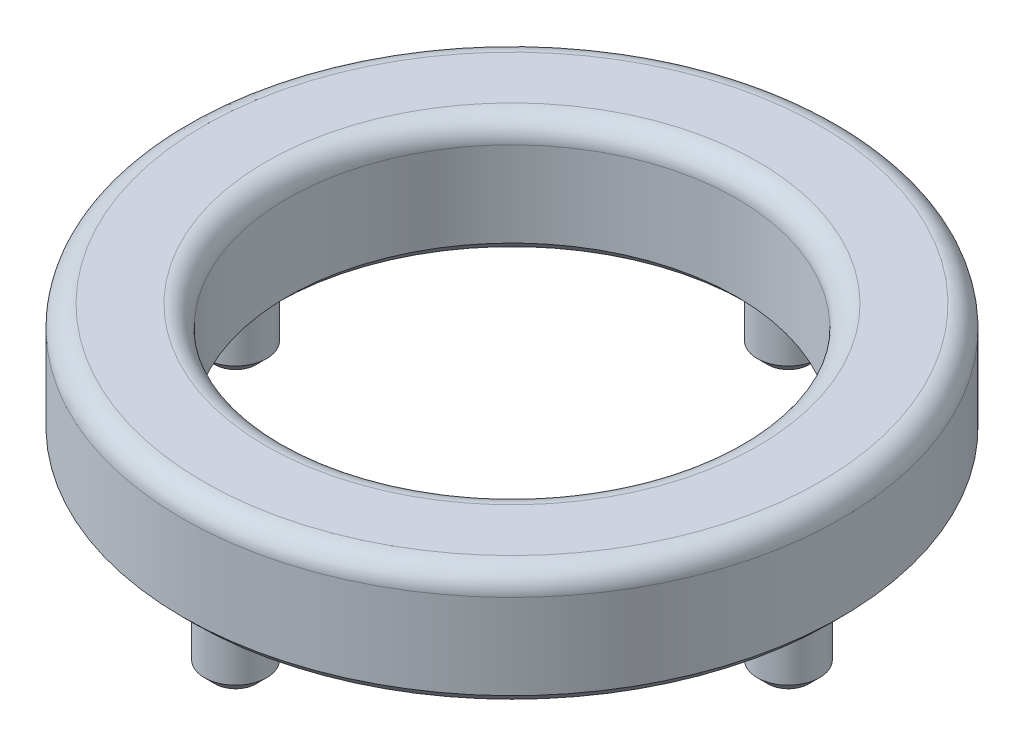
from build123d import *

# Parameters (mm, degrees)
SKETCH_1_R      = 31
SKETCH_1_R_2    = 21.15
EXTRUDE_1_DEPTH = 11
SKETCH_1_3_R    = 2.925
EXTRUDE_2_DEPTH = 6
CHAMFER_1_SIZE  = 1
CHAMFER_2_SIZE  = 1
FILLET_1_R      = 2
FILLET_2_R      = 0.4


with BuildPart() as part:
    # Эскиз1 → Бобышка-Вытянуть1 (new body)
    with BuildSketch(Plane(origin=(0, 0, 0), x_dir=(1, 0, 0), z_dir=(0, 1, 0))):
        Circle(SKETCH_1_R)
        Circle(SKETCH_1_R_2, mode=Mode.SUBTRACT)
    extrude(amount=EXTRUDE_1_DEPTH)

    # Эскиз1<3> → Бобышка-Вытянуть2 (add)
    with BuildSketch(Plane(origin=(0, 0, 0), x_dir=(1, 0, 0), z_dir=(0, 1, 0))):
        with Locations((0, 26)):
            Circle(SKETCH_1_3_R)
        with Locations((26, 0)):
            Circle(SKETCH_1_3_R)
        with Locations((0, -26)):
            Circle(SKETCH_1_3_R)
        with Locations((-26, 0)):
            Circle(SKETCH_1_3_R)
    extrude(amount=-EXTRUDE_2_DEPTH)

    # Фаска1
    chamfer_1_edges = [part.edges().sort_by_distance(p)[0] for p in [
        (-28.925, -6, 0),
        (-2.925, -6, -26),
        (23.075, -6, 0),
        (-2.925, -6, 26),
    ]]
    chamfer(chamfer_1_edges, length=CHAMFER_1_SIZE)

    # Фаска2
    chamfer_2_edges = [part.edges().sort_by_distance(p)[0] for p in [
        (-21.15, 0, 0),
        (-31, 0, 0),
    ]]
    chamfer(chamfer_2_edges, length=CHAMFER_2_SIZE)

    # Скругление1
    fillet_1_edges = [part.edges().sort_by_distance(p)[0] for p in [
        (-21.15, 11, 0),
        (-31, 11, 0),
    ]]
    fillet(fillet_1_edges, radius=FILLET_1_R)

    # Скругление2
    fillet_2_edges = [part.edges().sort_by_distance(p)[0] for p in [
        (23.075, 0, 0),
        (-2.925, 0, 26),
        (-28.925, 0, 0),
        (-2.925, 0, -26),
    ]]
    fillet(fillet_2_edges, radius=FILLET_2_R)


solid = part.part
